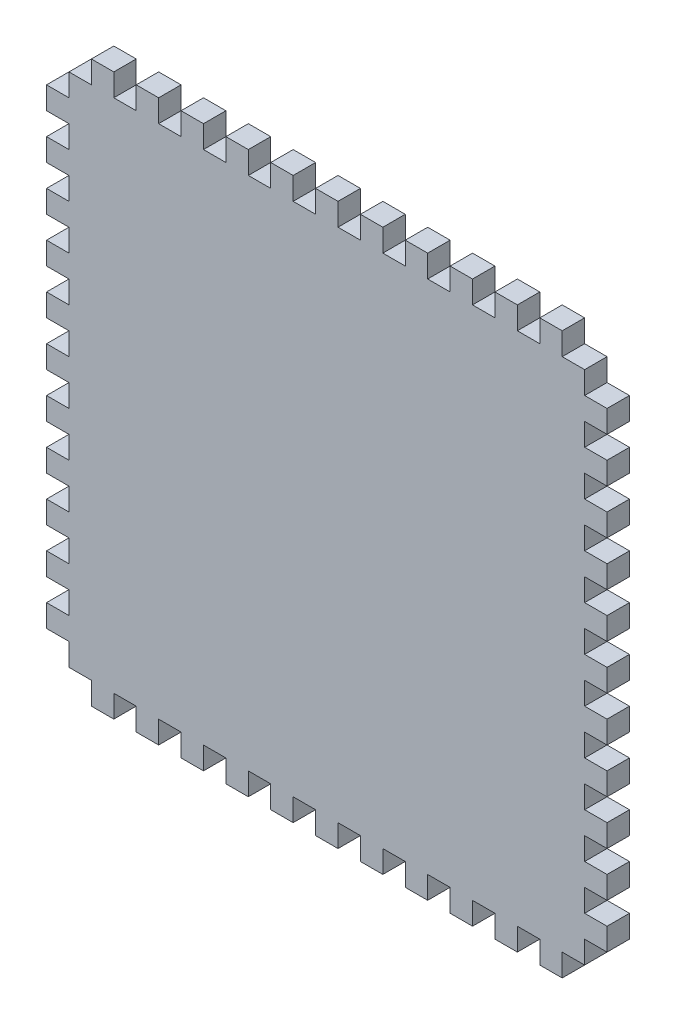
from build123d import *

# Parameters (mm, degrees)
BOSS_EXTRUDE1_DEPTH = 3


with BuildPart() as part:
    # Sketch1 → Boss-Extrude1 (new body)
    with BuildSketch(Plane.XY):
        Polygon((219, 51), (219, 48), (216, 48), (216, 45), (219, 45), (219, 42), (216, 42), (216, 39), (219, 39), (219, 36), (216, 36), (216, 33), (219, 33), (219, 30), (216, 30), (216, 27), (219, 27), (219, 24), (216, 24), (216, 21), (219, 21), (219, 18), (216, 18), (216, 15), (219, 15), (219, 12), (216, 12), (216, 9), (219, 9), (219, 6), (222, 6), (222, 3), (225, 3), (225, 6), (228, 6), (228, 3), (231, 3), (231, 6), (234, 6), (234, 3), (237, 3), (237, 6), (240, 6), (240, 3), (243, 3), (243, 6), (246, 6), (246, 3), (249, 3), (249, 6), (252, 6), (252, 3), (255, 3), (255, 6), (258, 6), (258, 3), (261, 3), (261, 6), (264, 6), (264, 3), (267, 3), (267, 6), (270, 6), (270, 3), (273, 3), (273, 6), (276, 6), (276, 3), (279, 3), (279, 6), (282, 6), (282, 3), (285, 3), (285, 6), (288, 6), (288, 9), (291, 9), (291, 12), (288, 12), (288, 15), (291, 15), (291, 18), (288, 18), (288, 21), (291, 21), (291, 24), (288, 24), (288, 27), (291, 27), (291, 30), (288, 30), (288, 33), (291, 33), (291, 36), (288, 36), (288, 39), (291, 39), (291, 42), (288, 42), (288, 45), (291, 45), (291, 48), (288, 48), (288, 51), (291, 51), (291, 54), (288, 54), (288, 57), (291, 57), (291, 60), (288, 60), (288, 63), (291, 63), (291, 66), (288, 66), (288, 69), (291, 69), (291, 72), (288, 72), (288, 75), (285, 75), (285, 78), (282, 78), (282, 75), (279, 75), (279, 78), (276, 78), (276, 75), (273, 75), (273, 78), (270, 78), (270, 75), (267, 75), (267, 78), (264, 78), (264, 75), (261, 75), (261, 78), (258, 78), (258, 75), (255, 75), (255, 78), (252, 78), (252, 75), (249, 75), (249, 78), (246, 78), (246, 75), (243, 75), (243, 78), (240, 78), (240, 75), (237, 75), (237, 78), (234, 78), (234, 75), (231, 75), (231, 78), (228, 78), (228, 75), (225, 75), (225, 78), (222, 78), (222, 75), (219, 75), (219, 72), (216, 72), (216, 69), (219, 69), (219, 66), (216, 66), (216, 63), (219, 63), (219, 60), (216, 60), (216, 57), (219, 57), (219, 54), (216, 54), (216, 51), align=None)
    extrude(amount=BOSS_EXTRUDE1_DEPTH)


solid = part.part
